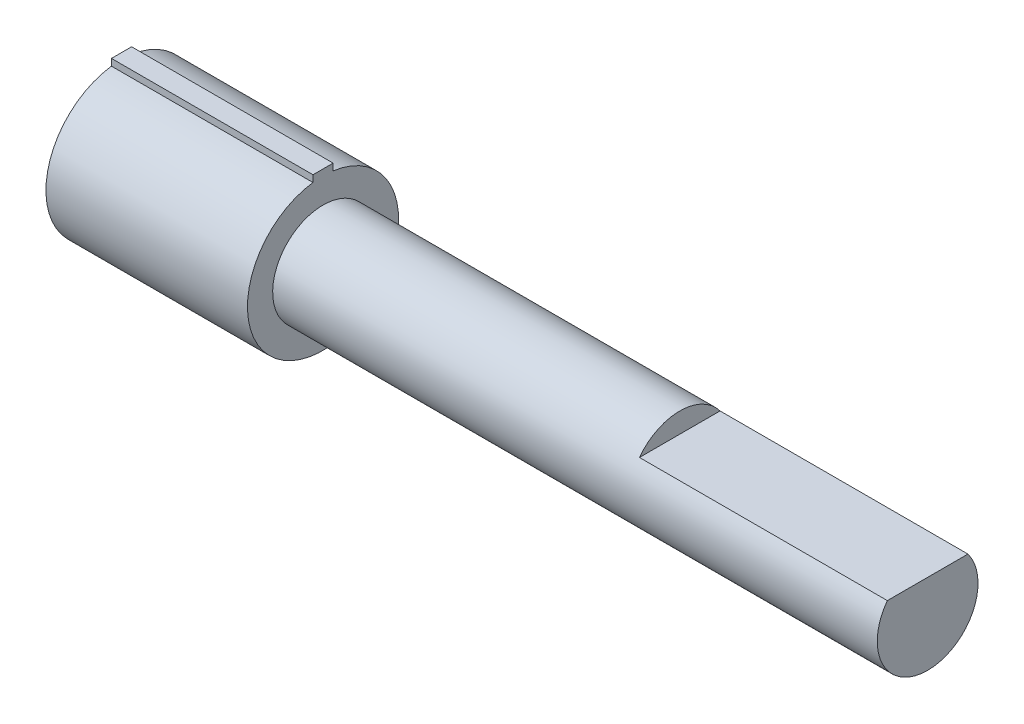
from build123d import *

# Parameters (mm, degrees)
SKETCH1_R           = 4.7625
SKETCH1_R_2         = 2.54
SKETCH1_R_3         = 1.5875
BOSS_EXTRUDE1_DEPTH = 12.7
SKETCH2_R           = 2.54
CUT_EXTRUDE1_DEPTH  = 9.525
SKETCH3_R           = 3.175
BOSS_EXTRUDE2_DEPTH = 38.1
SKETCH4_W           = 1.27
SKETCH4_H           = 0.762
BOSS_EXTRUDE3_DEPTH = 12.7
CUT_EXTRUDE2_START  = -15.621
CUT_EXTRUDE2_DEPTH  = 15.621


with BuildPart() as part:
    # Sketch1 → Boss-Extrude1 (new body)
    # profile 1 of 3: a face of its own
    with BuildSketch(Plane(origin=(0, 0, 0), x_dir=(0, 0, -1), z_dir=(1, 0, 0))):
        Circle(SKETCH1_R)
        Circle(SKETCH1_R_2, mode=Mode.SUBTRACT)
    # profile 2 of 3: a face of its own
    with BuildSketch(Plane(origin=(0, 0, 0), x_dir=(0, 0, -1), z_dir=(1, 0, 0))):
        Circle(SKETCH1_R_2)
        Circle(SKETCH1_R_3, mode=Mode.SUBTRACT)
    # profile 3 of 3: a face of its own
    with BuildSketch(Plane(origin=(0, 0, 0), x_dir=(0, 0, -1), z_dir=(1, 0, 0))):
        Circle(SKETCH1_R_3)
    extrude(amount=BOSS_EXTRUDE1_DEPTH)

    # Sketch2 → Cut-Extrude1 (cut)
    with BuildSketch(Plane.ZY):
        Circle(SKETCH2_R)
    extrude(amount=-CUT_EXTRUDE1_DEPTH, mode=Mode.SUBTRACT)

    # Sketch3 → Boss-Extrude2 (add)
    with BuildSketch(Plane(origin=(12.7, 0, 0), x_dir=(0, 0, -1), z_dir=(1, 0, 0))):
        with Locations(Location((0, 0, 0), (0, 0, 180))):
            Circle(SKETCH3_R)
    extrude(amount=BOSS_EXTRUDE2_DEPTH)

    # Sketch4 → Boss-Extrude3 (add)
    with BuildSketch(Plane(origin=(12.7, 0, 0), x_dir=(0, 0, -1), z_dir=(1, 0, 0))):
        with Locations((0, 4.7625)):
            Rectangle(SKETCH4_W, SKETCH4_H)
    extrude(amount=-BOSS_EXTRUDE3_DEPTH)

    # Sketch5 → Cut-Extrude2 (cut)
    with BuildSketch(Plane(origin=(50.8, 0, 0), x_dir=(0, 0, -1), z_dir=(1, 0, 0)).offset(CUT_EXTRUDE2_START)):
        with BuildLine():
            Line((-2.54, 1.905), (2.54, 1.905))
            ThreePointArc((2.54, 1.905), (0, 3.175), (-2.54, 1.905))
        make_face()
    extrude(amount=CUT_EXTRUDE2_DEPTH, mode=Mode.SUBTRACT)


solid = part.part
